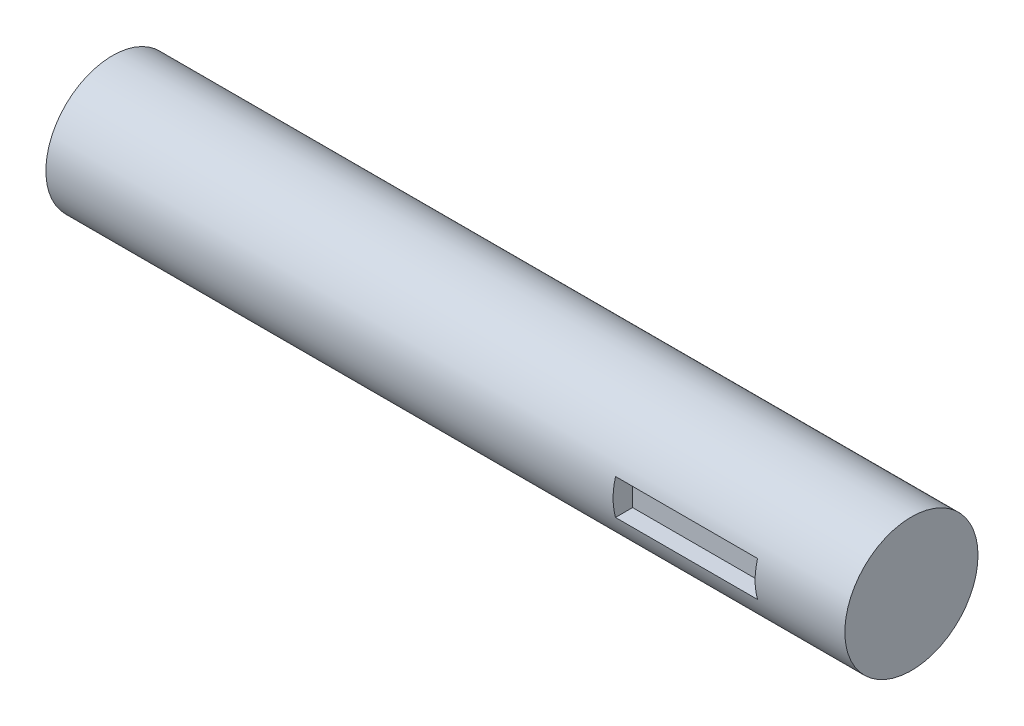
from build123d import *

# Parameters (mm, degrees)
SKETCH2_W          = 180
SKETCH2_H          = 15
SKETCH3_W          = 32
SKETCH3_H          = 8
CUT_EXTRUDE1_DEPTH = 4.4


with BuildPart() as part:
    # Sketch2 → Revolve1 (revolve)
    with BuildSketch(Plane.XY, mode=Mode.PRIVATE) as revolve1_sk:
        with Locations((90, 7.5)):
            Rectangle(SKETCH2_W, SKETCH2_H)
    revolve(revolve1_sk.sketch.rotate(Axis((0, 0, 0), (-1, 0, 0)), 90), axis=Axis((0, 0, 0), (-1, 0, 0)))

    # Sketch3 → Cut-Extrude1 (cut)
    with BuildSketch(Plane.XY.offset(15)):
        with Locations((143.786391812, 0)):
            Rectangle(SKETCH3_W, SKETCH3_H)
    extrude(amount=-CUT_EXTRUDE1_DEPTH, mode=Mode.SUBTRACT)


solid = part.part
